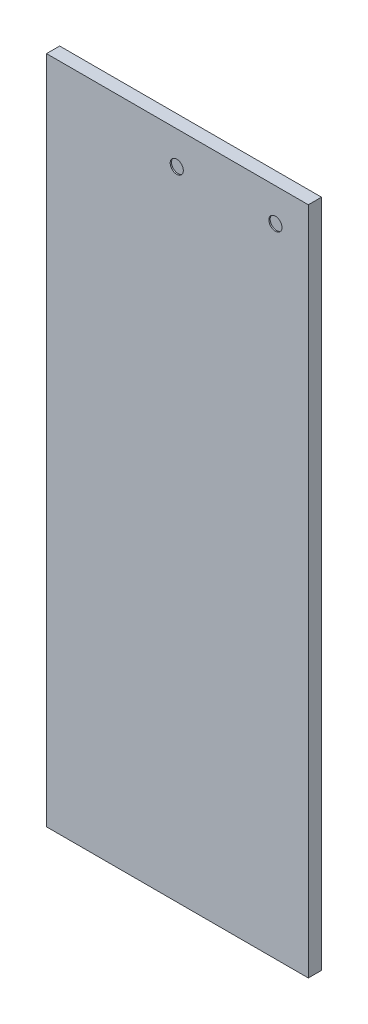
from build123d import *

# Parameters (mm, degrees)
SKETCH1_W           = 398
SKETCH1_H           = 1018
BOSS_EXTRUDE1_DEPTH = 20
SKETCH2_R           = 10
CUT_EXTRUDE1_DEPTH  = 2


with BuildPart() as part:
    # Sketch1 → Boss-Extrude1 (new body)
    with BuildSketch(Plane.XY):
        Rectangle(SKETCH1_W, SKETCH1_H)
    extrude(amount=BOSS_EXTRUDE1_DEPTH)

    # Sketch2 → Cut-Extrude1 (cut)
    with BuildSketch(Plane.XY.offset(20)):
        with Locations((149, 459)):
            Circle(SKETCH2_R)
        with Locations((-1, 459)):
            Circle(SKETCH2_R)
    extrude(amount=-CUT_EXTRUDE1_DEPTH, mode=Mode.SUBTRACT)


solid = part.part
